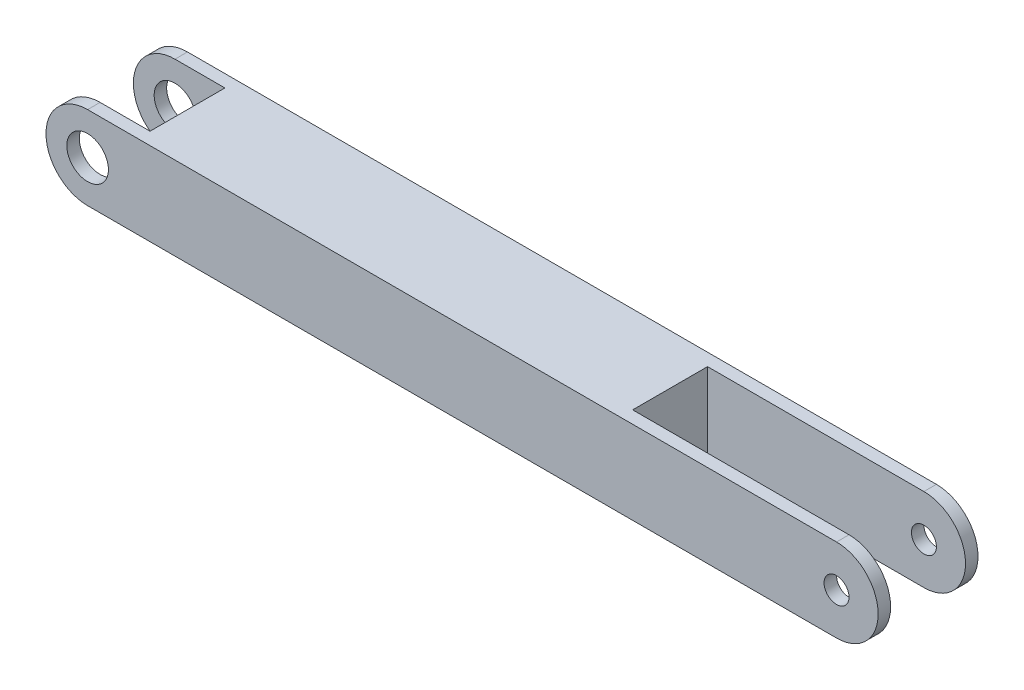
from build123d import *

# Parameters (mm, degrees)
EXTRUDE_1_DEPTH     = 6
SKETCH_2_R          = 2.5
SKETCH_2_R_2        = 1.5
CUT_EXTRUDE_1_DEPTH = 12
CUT_EXTRUDE_2_DEPTH = 4.5


with BuildPart() as part:
    # 草图1 → 凸台-拉伸1 (new, symmetric)
    with BuildSketch(Plane.XY):
        with BuildLine():
            Line((-50.916030534, 15.534351145), (39.083969466, 15.534351145))
            ThreePointArc((39.083969466, 15.534351145), (44.083969466, 10.534351145), (39.083969466, 5.534351145))
            Line((39.083969466, 5.534351145), (-50.916030534, 5.534351145))
            ThreePointArc((-50.916030534, 5.534351145), (-55.916030534, 10.534351145), (-50.916030534, 15.534351145))
        make_face()
    extrude(amount=EXTRUDE_1_DEPTH, both=True)

    # 草图2 → 切除-拉伸1 (cut)
    with BuildSketch(Plane.XY.offset(6)):
        with Locations((-50.916030534, 10.534351145)):
            Circle(SKETCH_2_R)
        with Locations((39.083969466, 10.534351145)):
            Circle(SKETCH_2_R_2)
    extrude(amount=-CUT_EXTRUDE_1_DEPTH, mode=Mode.SUBTRACT)

    # 草图3 → 切除-拉伸2 (cut, symmetric)
    with BuildSketch(Plane.XY):
        with BuildLine():
            Line((39.083969466, 15.534351145), (13.083969466, 15.534351145))
            Line((13.083969466, 15.534351145), (13.083969466, 5.534351145))
            Line((13.083969466, 5.534351145), (39.083969466, 5.534351145))
            ThreePointArc((39.083969466, 5.534351145), (44.083969466, 10.534351145), (39.083969466, 15.534351145))
        make_face()
        with BuildLine():
            Line((-50.916030534, 15.534351145), (-44.916030534, 15.534351145))
            Line((-44.916030534, 15.534351145), (-44.916030534, 5.534351145))
            Line((-44.916030534, 5.534351145), (-50.916030534, 5.534351145))
            ThreePointArc((-50.916030534, 5.534351145), (-55.916030534, 10.534351145), (-50.916030534, 15.534351145))
        make_face()
    extrude(amount=CUT_EXTRUDE_2_DEPTH, both=True, mode=Mode.SUBTRACT)


solid = part.part
